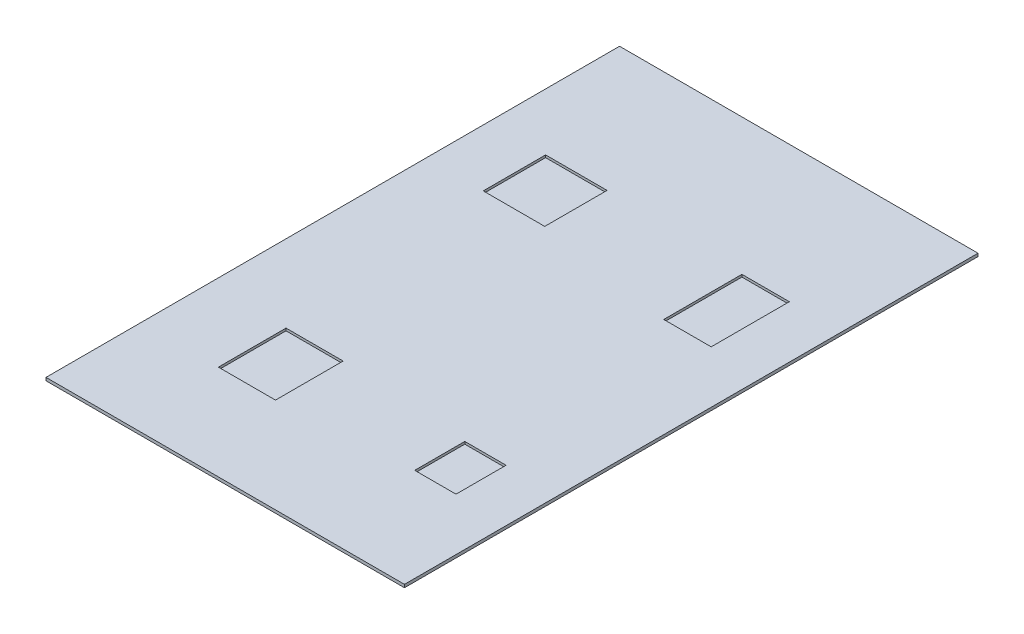
from build123d import *

# Parameters (mm, degrees)
SKETCH1_W           = 381
SKETCH1_H           = 609.6
BOSS_EXTRUDE1_DEPTH = 3.175
SKETCH2_W           = 65.353056765
SKETCH2_H           = 66.286671862
SKETCH2_W_2         = 50.415215219
SKETCH2_H_2         = 83.091743602
SKETCH2_W_3         = 60.684981282
SKETCH2_H_3         = 71.888362442
SKETCH2_W_4         = 43.879909543
SKETCH2_H_4         = 53.216060509
CUT_EXTRUDE1_DEPTH  = 2.54


with BuildPart() as part:
    # Sketch1 → Boss-Extrude1 (new body)
    with BuildSketch(Plane(origin=(0, 0, 0), x_dir=(1, 0, 0), z_dir=(0, 1, 0))):
        Rectangle(SKETCH1_W, SKETCH1_H)
    extrude(amount=BOSS_EXTRUDE1_DEPTH)

    # Sketch2 → Cut-Extrude1 (cut)
    with BuildSketch(Plane(origin=(0, 3.175, 0), x_dir=(1, 0, 0), z_dir=(0, 1, 0))):
        with Locations((-97.095970052, 132.33993995)):
            Rectangle(SKETCH2_W, SKETCH2_H)
        with Locations((109.699773857, 118.3357135)):
            Rectangle(SKETCH2_W_2, SKETCH2_H_2)
        with Locations((-77.95686057, -167.817313623)):
            Rectangle(SKETCH2_W_3, SKETCH2_H_3)
        with Locations((112.967426695, -167.817313623)):
            Rectangle(SKETCH2_W_4, SKETCH2_H_4)
    extrude(amount=-CUT_EXTRUDE1_DEPTH, mode=Mode.SUBTRACT)


solid = part.part
